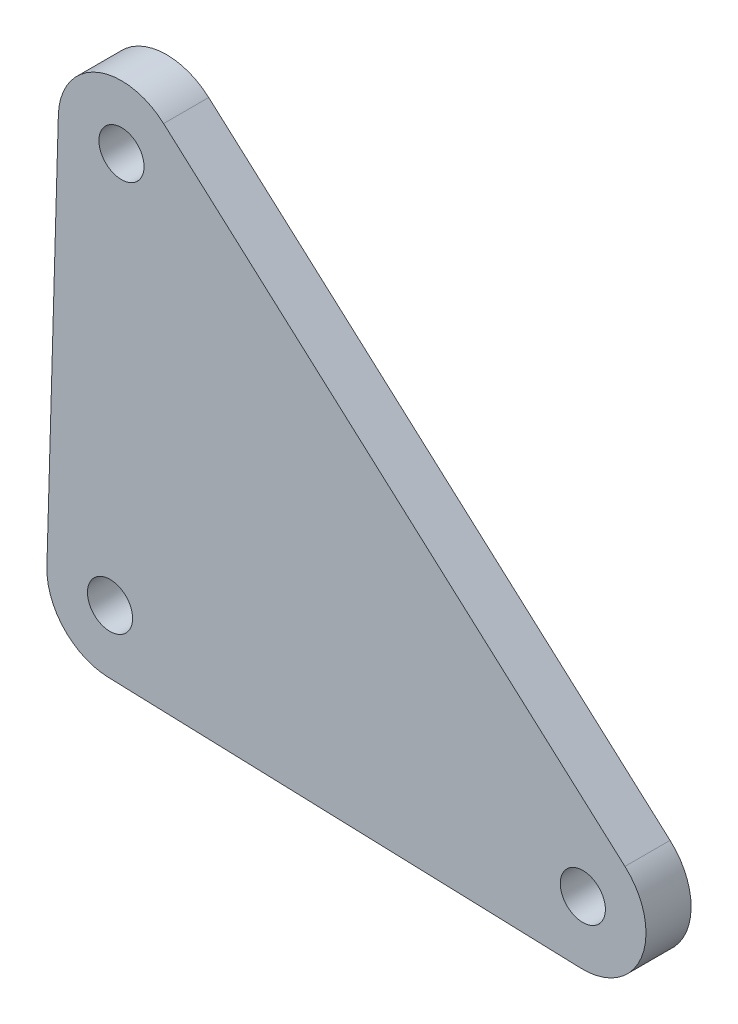
from build123d import *

# Parameters (mm, degrees)
SKETCH1_R           = 3.175
BOSS_EXTRUDE1_DEPTH = 6.35
FILLET1_R           = 8.89


with BuildPart() as part:
    # Sketch1 → Boss-Extrude1 (new body)
    with BuildSketch(Plane.XY):
        Polygon((-9.141712801, -8.592188489), (-6.721283646, 75.262377261), (90.721451865, -11.8986691), align=None)
        with Locations((1.612954285, 55.88)):
            Circle(SKETCH1_R, mode=Mode.SUBTRACT)
        Circle(SKETCH1_R, mode=Mode.SUBTRACT)
        with Locations((66.548, -2.203411763)):
            Circle(SKETCH1_R, mode=Mode.SUBTRACT)
    extrude(amount=BOSS_EXTRUDE1_DEPTH)

    # Fillet1
    fillet1_edges = [part.edges().sort_by_distance(p)[0] for p in [
        (-9.141712801, -8.592188489, 3.175),
        (-6.721283646, 75.262377261, 3.175),
        (90.721451865, -11.8986691, 3.175),
    ]]
    fillet(fillet1_edges, radius=FILLET1_R)


solid = part.part
